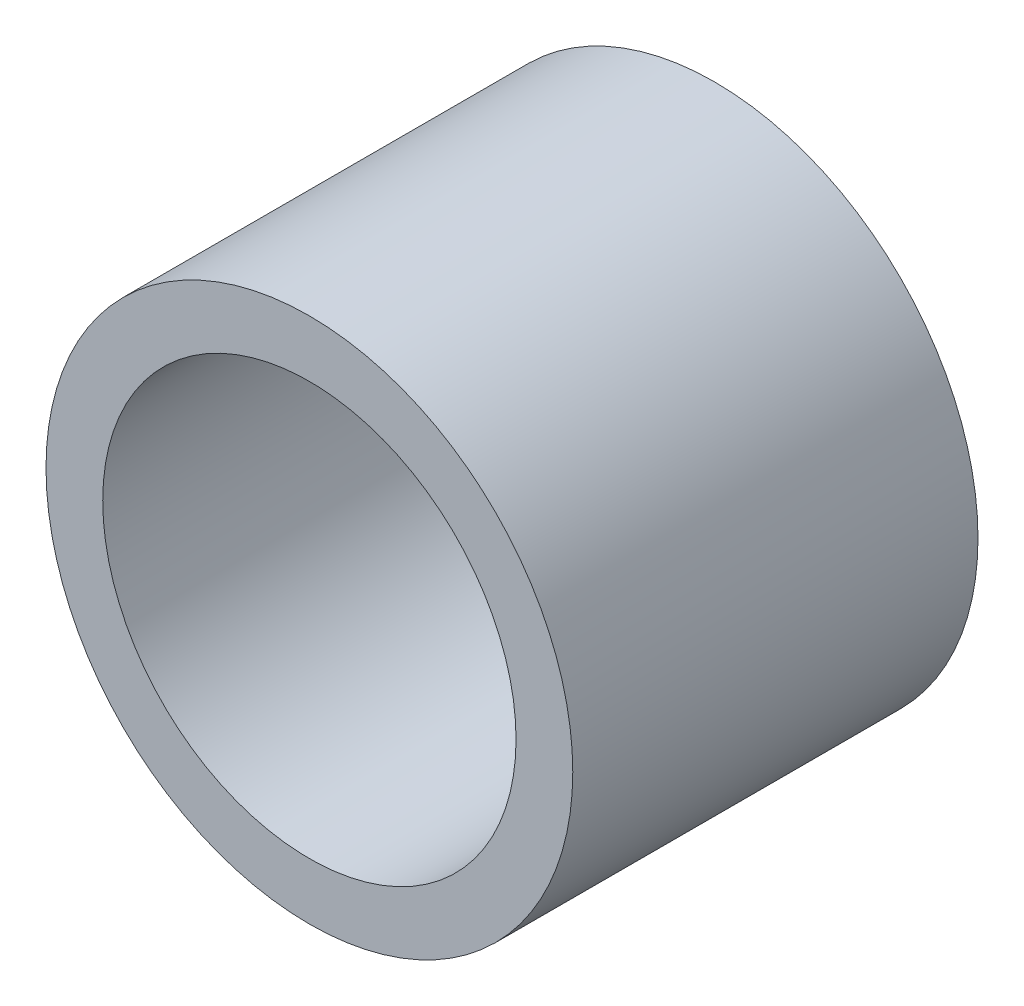
from build123d import *

# Parameters (mm, degrees)
SKETCH1_R           = 3.25
SKETCH1_R_2         = 2.55
BOSS_EXTRUDE1_DEPTH = 5


with BuildPart() as part:
    # Sketch1 → Boss-Extrude1 (new body)
    with BuildSketch(Plane.XY):
        Circle(SKETCH1_R)
        Circle(SKETCH1_R_2, mode=Mode.SUBTRACT)
    extrude(amount=BOSS_EXTRUDE1_DEPTH)


solid = part.part
